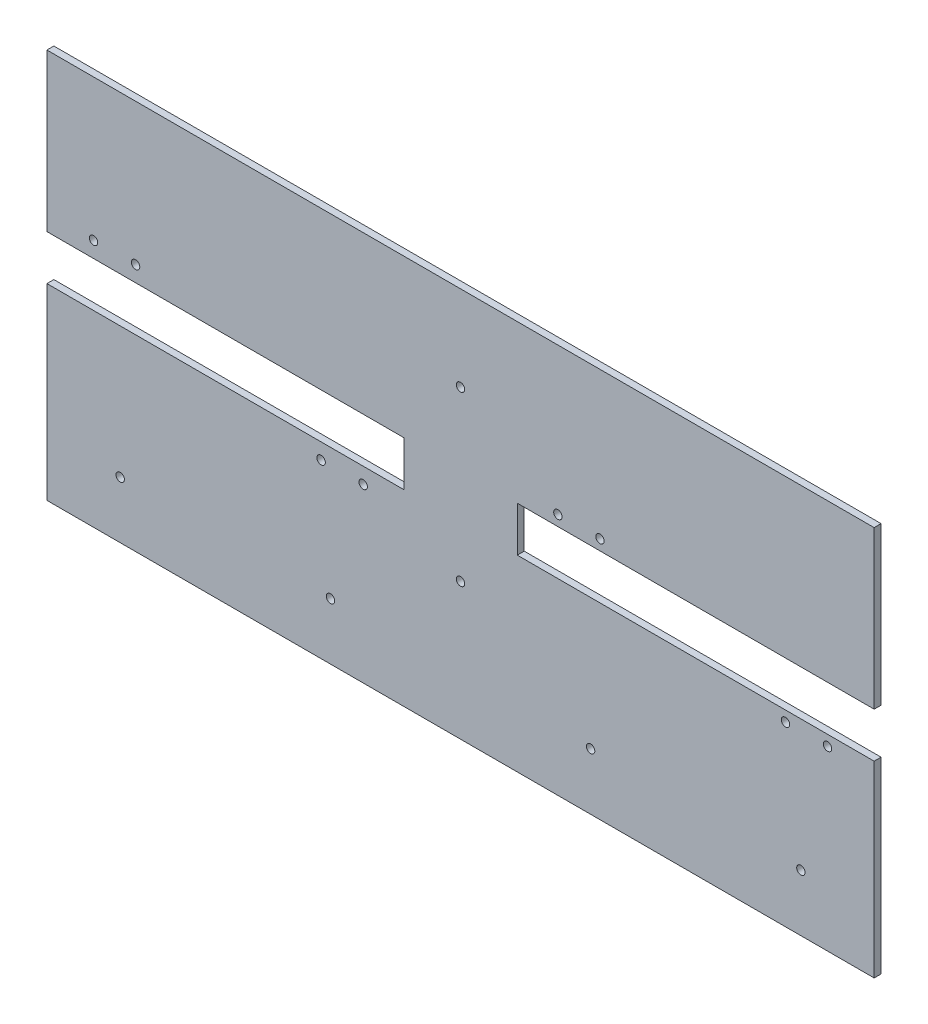
from build123d import *

# Parameters (mm, degrees)
SKETCH1_W           = 393.4
SKETCH1_H           = 185.491905347
BOSS_EXTRUDE1_DEPTH = 3.3
SKETCH2_R           = 2.00000001
SKETCH2_R_2         = 2
CUT_EXTRUDE1_DEPTH  = 4
SKETCH3_W           = 169.7
SKETCH3_H           = 21.4
CUT_EXTRUDE2_DEPTH  = 6
SKETCH4_R           = 2
CUT_EXTRUDE3_DEPTH  = 276.628325081


with BuildPart() as part:
    # Sketch1 → Boss-Extrude1 (new body)
    with BuildSketch(Plane.XY):
        with Locations((27, 68.245952673)):
            Rectangle(SKETCH1_W, SKETCH1_H)
    extrude(amount=BOSS_EXTRUDE1_DEPTH)

    # Sketch2 → Cut-Extrude1 (cut)
    with BuildSketch(Plane(origin=(0, 0, 0), x_dir=(-1, 0, 0), z_dir=(0, 0, -1))):
        with Locations((-27, 40.495952673)):
            Circle(SKETCH2_R)
        with Locations((-27, 120.495952673)):
            Circle(SKETCH2_R)
        with Locations((-188.85, 2.5)):
            Circle(SKETCH2_R_2)
        with Locations((-88.85, 2.5)):
            Circle(SKETCH2_R_2)
        with Locations((34.85, 2.5)):
            Circle(SKETCH2_R_2)
        with Locations((134.85, 2.5)):
            Circle(SKETCH2_R_2)
    extrude(amount=-CUT_EXTRUDE1_DEPTH, mode=Mode.SUBTRACT)

    # Sketch3 → Cut-Extrude2 (cut)
    with BuildSketch(Plane(origin=(0, 0, 0), x_dir=(-1, 0, 0), z_dir=(0, 0, -1))):
        with Locations((84.85, 75.5)):
            Rectangle(SKETCH3_W, SKETCH3_H)
        with Locations((-138.85, 75.5)):
            Rectangle(SKETCH3_W, SKETCH3_H)
    extrude(amount=-CUT_EXTRUDE2_DEPTH, mode=Mode.SUBTRACT)

    # Sketch4 → Cut-Extrude3 (cut, through all)
    with BuildSketch(Plane.XY.offset(3.3)):
        with Locations((93.303368669, 91.2)):
            Circle(SKETCH4_R)
        with Locations((73.303368669, 91.2)):
            Circle(SKETCH4_R)
        with Locations((181.525840122, 59.8)):
            Circle(SKETCH4_R)
        with Locations((201.525840122, 59.8)):
            Circle(SKETCH4_R)
        with Locations((-127.525840122, 93.7)):
            Circle(SKETCH4_R)
        with Locations((-147.525840122, 93.7)):
            Circle(SKETCH4_R)
        with Locations((-19.303368669, 57.3)):
            Circle(SKETCH4_R)
        with Locations((-39.303368669, 57.3)):
            Circle(SKETCH4_R)
    extrude(amount=-CUT_EXTRUDE3_DEPTH, mode=Mode.SUBTRACT)


solid = part.part
